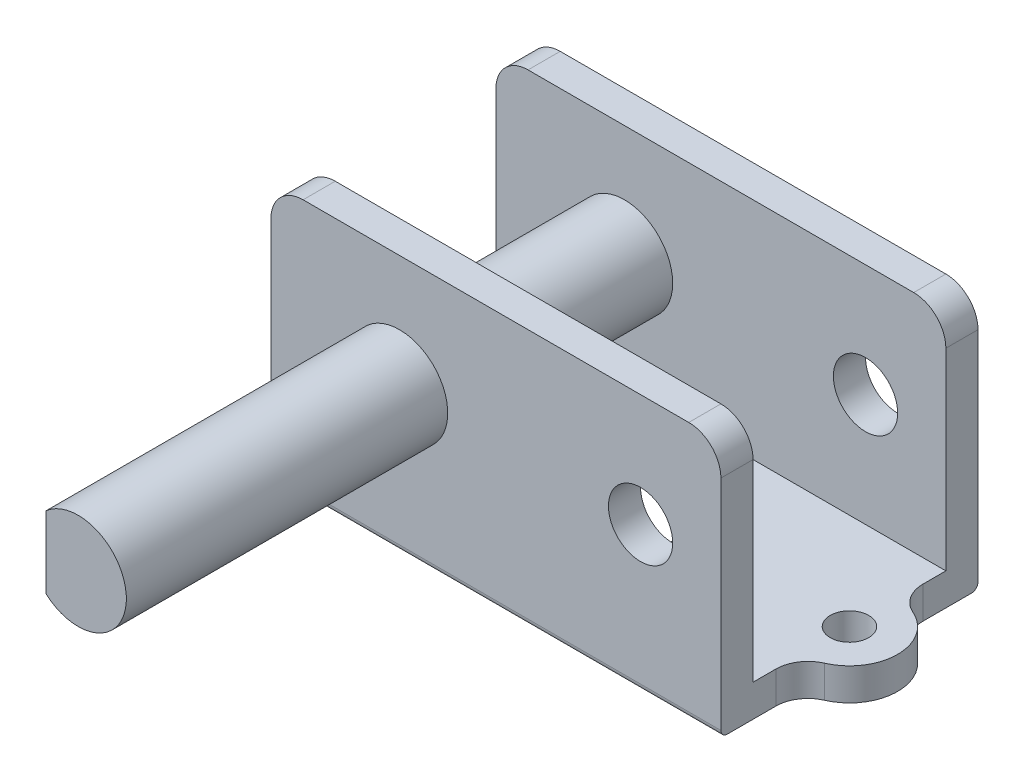
from build123d import *

# Parameters (mm, degrees)
EXTRUDE1_DEPTH      = 4
EXTRUDE2_DEPTH      = 12.357816692
EXTRUDE2_DEPTH_BACK = 12.357816692
SKETCH2_R           = 1
EXTRUDE3_DEPTH      = 12.357816692
EXTRUDE3_DEPTH_BACK = 12.357816692
SKETCH4_W           = 6
SKETCH4_H           = 8.732029078
FILLET1_R           = 0.2
FILLET2_R           = 1
EXTRUDE4_DEPTH      = 14
EXTRUDE4_DEPTH_BACK = 3
SKETCH3_R           = 1.5
EXTRUDE5_DEPTH      = 9
SKETCH6_R           = 1.5
EXTRUDE6_DEPTH      = 1
SKETCH7_R           = 0.6
EXTRUDE7_DEPTH      = 1
FILLET3_R           = 1
SKETCH8_R           = 2
EXTRUDE8_DEPTH      = 1


with BuildPart() as part:
    # Sketch1 → Extrude1 (new, symmetric)
    with BuildSketch(Plane.XY):
        Polygon((0, 0), (-7, 0), (-7, 8), (7, 8), (7, 0), align=None)
    extrude(amount=EXTRUDE1_DEPTH, both=True)

    # Sketch2 → Extrude2 (cut, two sides: drawn at the far end of the back side and taken through both)
    with BuildSketch(Plane.XY.offset(-EXTRUDE2_DEPTH_BACK)):
        with Locations((4.5, 4.5)):
            Circle(SKETCH2_R)
    extrude(amount=EXTRUDE2_DEPTH + EXTRUDE2_DEPTH_BACK, mode=Mode.SUBTRACT)

    # Sketch4 → Extrude3 (cut, two sides: drawn at the far end of the back side and taken through both)
    with BuildSketch(Plane(origin=(0, 0, 0), x_dir=(0, 0, -1), z_dir=(1, 0, 0)).offset(-EXTRUDE3_DEPTH_BACK)):
        with Locations((0, 5.366014539)):
            Rectangle(SKETCH4_W, SKETCH4_H)
    extrude(amount=EXTRUDE3_DEPTH + EXTRUDE3_DEPTH_BACK, mode=Mode.SUBTRACT)

    # Fillet1
    fillet1_edges = [part.edges().sort_by_distance(p)[0] for p in [
        (0, 0, 4),
        (0, 0, -4),
    ]]
    fillet(fillet1_edges, radius=FILLET1_R)

    # Fillet2
    fillet2_edges = [part.edges().sort_by_distance(p)[0] for p in [
        (-7, 8, -3.5),
        (7, 8, -3.5),
        (-7, 8, 3.5),
        (7, 8, 3.5),
    ]]
    fillet(fillet2_edges, radius=FILLET2_R)

    # Sketch3 → Extrude4 (add, two sides: drawn at the far end of the back side and taken through both)
    with BuildSketch(Plane.XY.offset(-EXTRUDE4_DEPTH_BACK)):
        with Locations((-3, 4.5)):
            Circle(SKETCH3_R)
    extrude(amount=EXTRUDE4_DEPTH + EXTRUDE4_DEPTH_BACK)

    # Sketch5 → Extrude5 (cut)
    with BuildSketch(Plane.XY.offset(14)):
        Polygon((-4, 4.5), (-4, 6.060686456), (-4.95644391, 6.060686456), (-4.95644391, 2.5), (-4, 2.5), align=None)
    extrude(amount=-EXTRUDE5_DEPTH, mode=Mode.SUBTRACT)

    # Sketch6 → Extrude6 (add)
    with BuildSketch(Plane.XZ):
        with Locations((-7, 0)):
            Circle(SKETCH6_R)
        with Locations((7, 0)):
            Circle(SKETCH6_R)
    extrude(amount=-EXTRUDE6_DEPTH)

    # Sketch7 → Extrude7 (cut)
    with BuildSketch(Plane.XZ):
        with Locations((-7, 0)):
            Circle(SKETCH7_R)
        with Locations((7, 0)):
            Circle(SKETCH7_R)
    extrude(amount=-EXTRUDE7_DEPTH, mode=Mode.SUBTRACT)

    # Fillet3
    fillet3_edges = [part.edges().sort_by_distance(p)[0] for p in [
        (7, 0.5, -1.5),
        (7, 0.5, 1.5),
        (-7, 0.5, 1.5),
        (-7, 0.5, -1.5),
    ]]
    fillet(fillet3_edges, radius=FILLET3_R)

    # Sketch8 → Extrude8 (cut)
    with BuildSketch(Plane.XZ):
        Circle(SKETCH8_R)
    extrude(amount=-EXTRUDE8_DEPTH, mode=Mode.SUBTRACT)


solid = part.part
